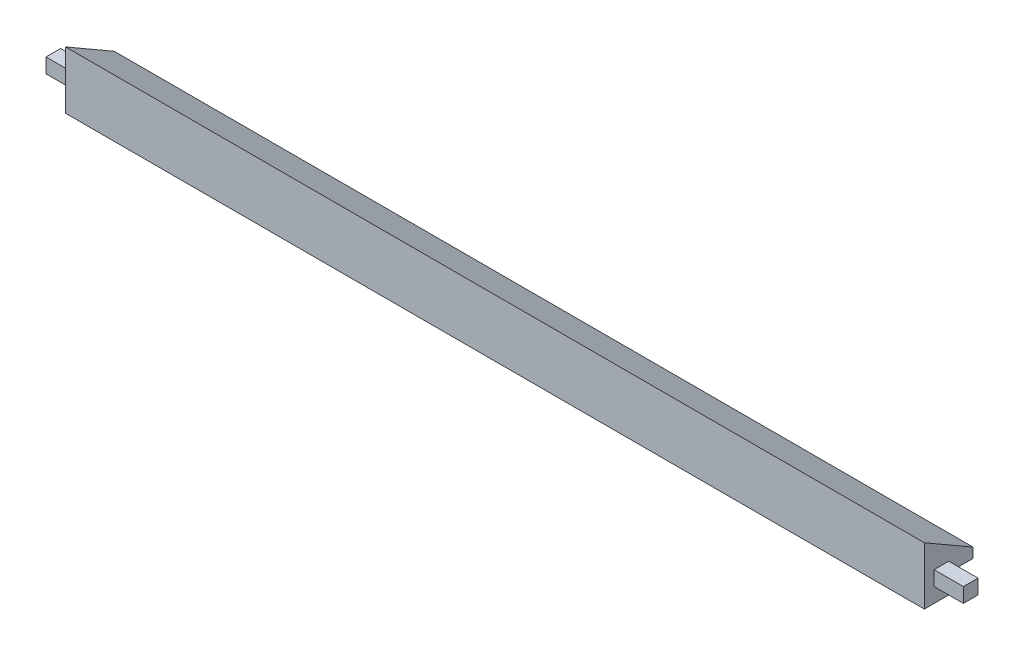
from build123d import *

# Parameters (mm, degrees)
BOSS_EXTRUDE1_DEPTH = 88
SKETCH2_W           = 2
SKETCH2_H           = 2
CUT_EXTRUDE1_DEPTH  = 88
SKETCH3_W           = 1.5
SKETCH3_H           = 1.5
BOSS_EXTRUDE2_DEPTH = 3
SKETCH4_W           = 1.5
SKETCH4_H           = 1.5
BOSS_EXTRUDE3_DEPTH = 3


with BuildPart() as part:
    # Sketch1 → Boss-Extrude1 (new body)
    with BuildSketch(Plane(origin=(0, 0, 0), x_dir=(0, 0, -1), z_dir=(1, 0, 0))):
        Polygon((-1.402077652, -1.507305482), (3.597922348, -1.507305482), (3.597922348, 1.492694518), (-1.402077652, 4.381582518), align=None)
    extrude(amount=BOSS_EXTRUDE1_DEPTH)

    # Sketch2 → Cut-Extrude1 (cut)
    with BuildSketch(Plane.ZY):
        with Locations((-2.597922348, -0.507305482)):
            Rectangle(SKETCH2_W, SKETCH2_H)
    extrude(amount=-CUT_EXTRUDE1_DEPTH, mode=Mode.SUBTRACT)

    # Sketch3 → Boss-Extrude2 (add)
    with BuildSketch(Plane.ZY):
        with Locations((-0.347922348, 0.742694518)):
            Rectangle(SKETCH3_W, SKETCH3_H)
    extrude(amount=BOSS_EXTRUDE2_DEPTH)

    # Sketch4 → Boss-Extrude3 (add)
    with BuildSketch(Plane(origin=(88, 0, 0), x_dir=(0, 0, -1), z_dir=(1, 0, 0))):
        with Locations((0.347922348, 0.742694518)):
            Rectangle(SKETCH4_W, SKETCH4_H)
    extrude(amount=BOSS_EXTRUDE3_DEPTH)


solid = part.part
